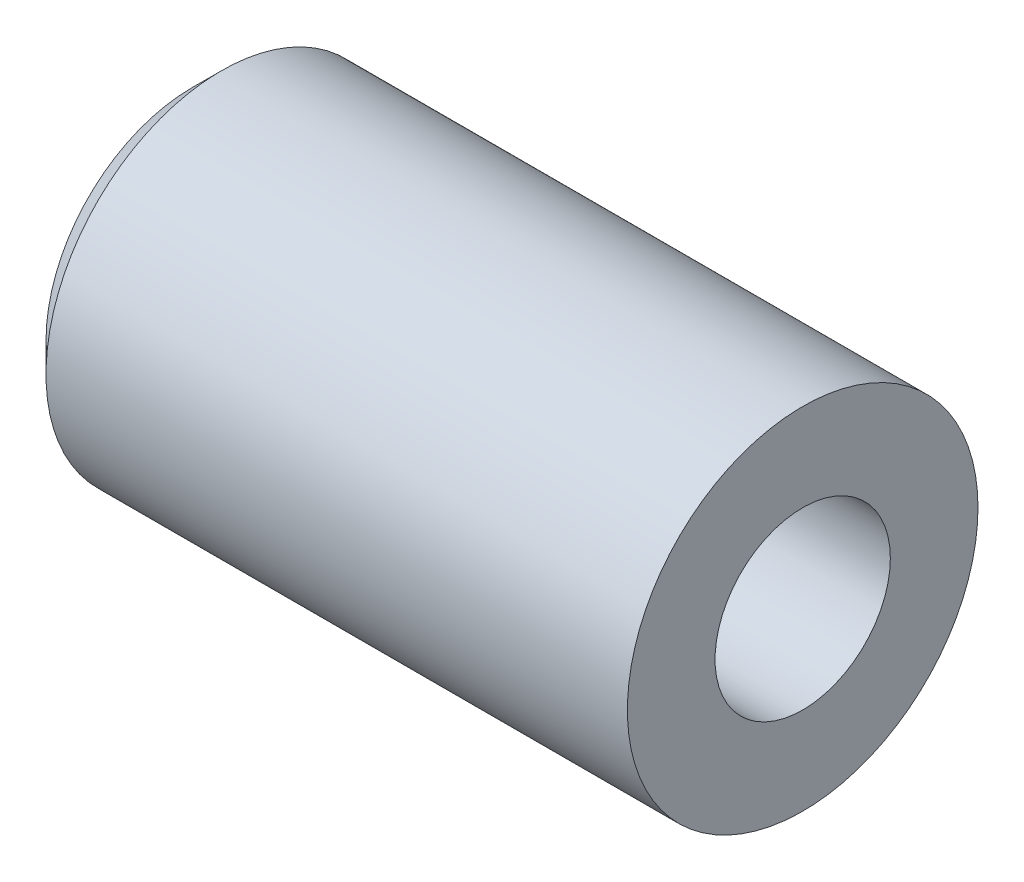
from build123d import *

# Parameters (mm, degrees)
SKETCH1_R           = 6
SKETCH1_R_2         = 3
BOSS_EXTRUDE1_DEPTH = 20.9
CHAMFER1_SIZE       = 1


with BuildPart() as part:
    # Sketch1 → Boss-Extrude1 (new body)
    with BuildSketch(Plane(origin=(0, 0, 0), x_dir=(0, 0, -1), z_dir=(1, 0, 0))):
        Circle(SKETCH1_R)
        Circle(SKETCH1_R_2, mode=Mode.SUBTRACT)
    extrude(amount=BOSS_EXTRUDE1_DEPTH)

    # Chamfer1
    chamfer1_edges = [part.edges().sort_by_distance(p)[0] for p in [
        (0, 0, 6),
    ]]
    chamfer(chamfer1_edges, length=CHAMFER1_SIZE)


solid = part.part
